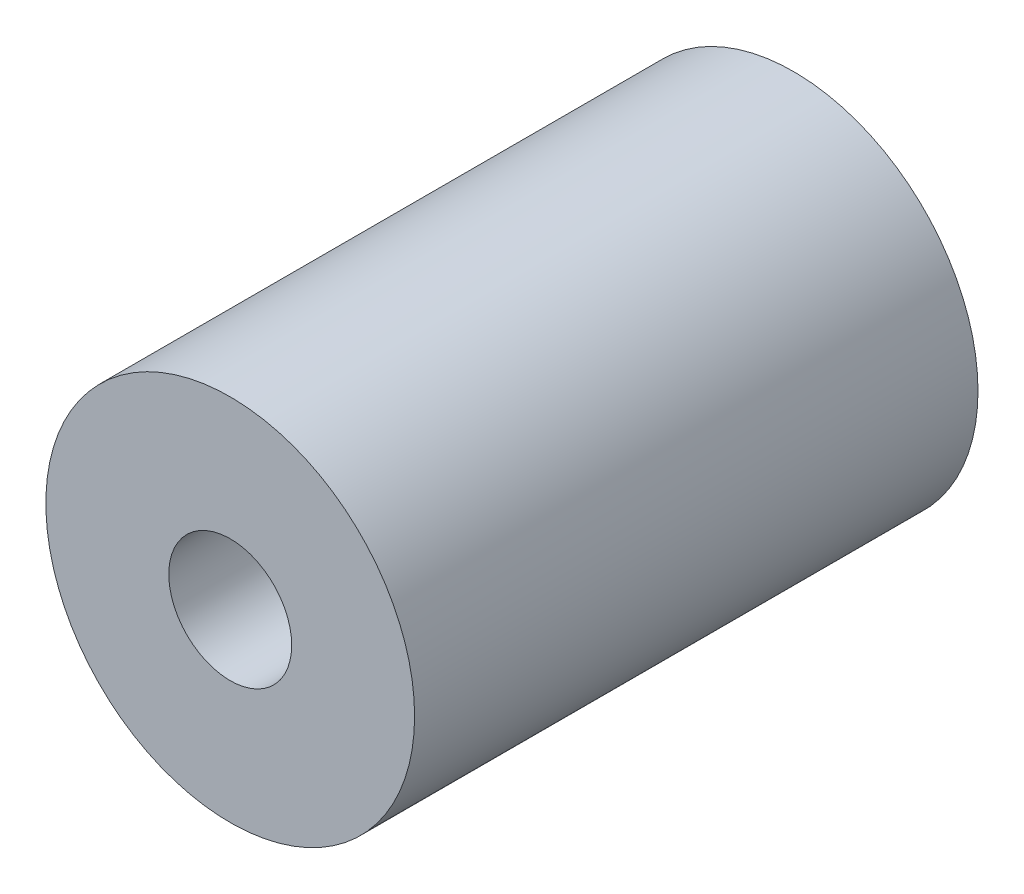
from build123d import *

# Parameters (mm, degrees)
SKETCH_1_R      = 9
SKETCH_1_R_2    = 3
EXTRUDE_1_DEPTH = 27.5


with BuildPart() as part:
    # Эскиз1 → Бобышка-Вытянуть1 (new body)
    with BuildSketch(Plane.XY):
        Circle(SKETCH_1_R)
        Circle(SKETCH_1_R_2, mode=Mode.SUBTRACT)
    extrude(amount=EXTRUDE_1_DEPTH)


solid = part.part
